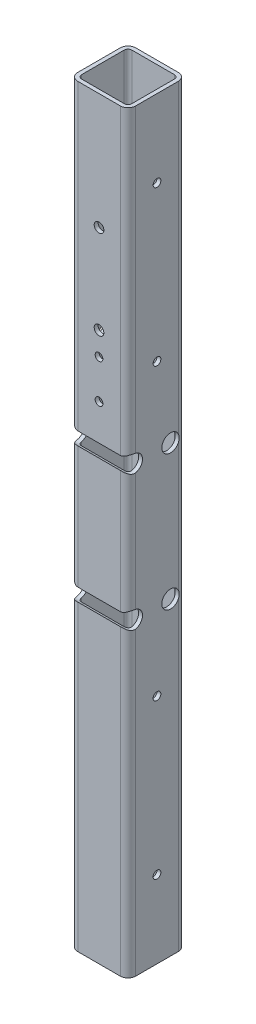
from build123d import *

# Parameters (mm, degrees)
EXTRUDE_1_DEPTH     = 195
SKETCH_2_R          = 4.5
SKETCH_2_R_2        = 2
CUT_EXTRUDE_1_DEPTH = 200.562020435
SKETCH_3_R          = 2.5
SKETCH_3_R_2        = 2
CUT_EXTRUDE_2_DEPTH = 200.562020563


with BuildPart() as part:
    # 草图1 → 凸台-拉伸1 (new, symmetric)
    with BuildSketch(Plane(origin=(0, 0, 0), x_dir=(1, 0, 0), z_dir=(0, 1, 0))):
        with BuildLine():
            Line((4, 0), (26, 0))
            ThreePointArc((26, 0), (28.828427125, 1.171572875), (30, 4))
            Line((30, 4), (30, 26))
            ThreePointArc((30, 26), (28.828427125, 28.828427125), (26, 30))
            Line((26, 30), (4, 30))
            ThreePointArc((4, 30), (1.171572875, 28.828427125), (0, 26))
            Line((0, 26), (0, 4))
            ThreePointArc((0, 4), (1.171572875, 1.171572875), (4, 0))
        make_face()
        with BuildLine():
            Line((4, 2), (26, 2))
            ThreePointArc((26, 2), (27.414213562, 2.585786438), (28, 4))
            Line((28, 4), (28, 26))
            ThreePointArc((28, 26), (27.414213562, 27.414213562), (26, 28))
            Line((26, 28), (4, 28))
            ThreePointArc((4, 28), (2.585786438, 27.414213562), (2, 26))
            Line((2, 26), (2, 4))
            ThreePointArc((2, 4), (2.585786438, 2.585786438), (4, 2))
        make_face(mode=Mode.SUBTRACT)
    extrude(amount=EXTRUDE_1_DEPTH, both=True)

    # 草图2 → 切除-拉伸1 (cut, through all)
    with BuildSketch(Plane(origin=(0, 0, 0), x_dir=(0, 0, -1), z_dir=(1, 0, 0))):
        with Locations((3, -35)):
            Circle(SKETCH_2_R)
        with Locations(Location((22, -35, 0), (0, 0, 332.733955549))):
            Circle(SKETCH_2_R)
        with Locations(Location((22, 35, 0), (0, 0, 332.733955549))):
            Circle(SKETCH_2_R)
        with Locations((3, 35)):
            Circle(SKETCH_2_R)
        with Locations(Location((15, -155, 0), (0, 0, 180))):
            Circle(SKETCH_2_R_2)
        with Locations(Location((15, -75, 0), (0, 0, 180))):
            Circle(SKETCH_2_R_2)
        with Locations(Location((15, 75, 0), (0, 0, 180))):
            Circle(SKETCH_2_R_2)
        with Locations(Location((15, 155, 0), (0, 0, 180))):
            Circle(SKETCH_2_R_2)
    extrude(amount=CUT_EXTRUDE_1_DEPTH, mode=Mode.SUBTRACT)

    # 草图3 → 切除-拉伸2 (cut, through all)
    with BuildSketch(Plane.XY):
        with Locations((15, 89)):
            Circle(SKETCH_3_R)
        with Locations((15, 135)):
            Circle(SKETCH_3_R)
        with Locations((15, 77)):
            Circle(SKETCH_3_R_2)
        with Locations((15, 57)):
            Circle(SKETCH_3_R_2)
    extrude(amount=-CUT_EXTRUDE_2_DEPTH, mode=Mode.SUBTRACT)


solid = part.part
